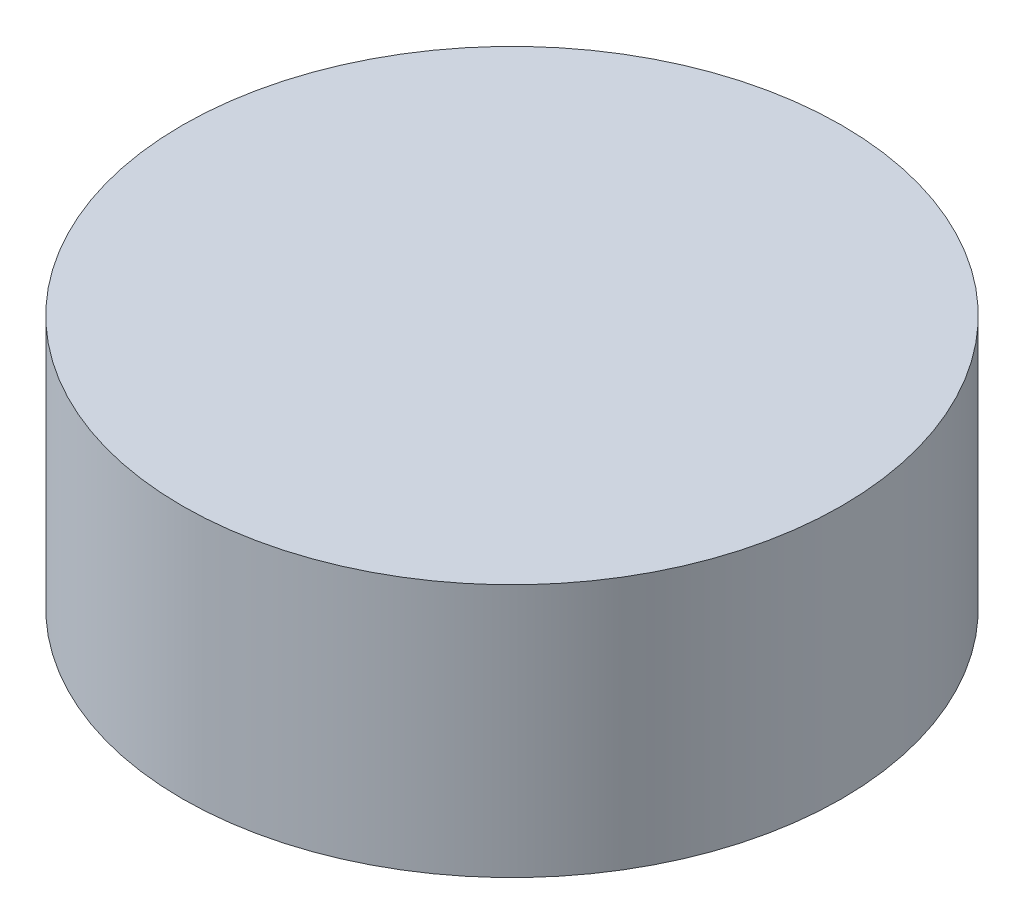
from build123d import *

# Parameters (mm, degrees)
SKETCH_1_R             = 32.5
ABOT_RIGHT_WHEEL_DEPTH = 25


with BuildPart() as part:
    # Эскиз1 → abot_right_wheel (new body)
    with BuildSketch(Plane(origin=(0, 0, 0), x_dir=(1, 0, 0), z_dir=(0, 1, 0))):
        Circle(SKETCH_1_R)
    extrude(amount=ABOT_RIGHT_WHEEL_DEPTH)


solid = part.part
